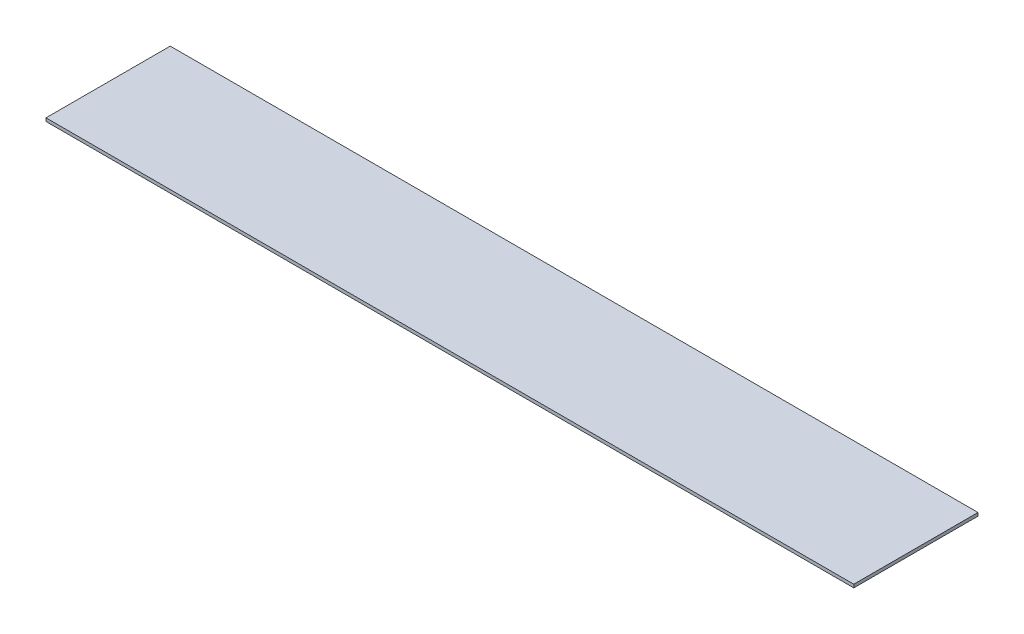
from build123d import *

# Parameters (mm, degrees)
SKETCH1_W           = 1201.674
SKETCH1_H           = 184.792366
BOSS_EXTRUDE2_DEPTH = 4.7625


with BuildPart() as part:
    # Sketch1 → Boss-Extrude2 (new body)
    with BuildSketch(Plane(origin=(0, 0, 0), x_dir=(1, 0, 0), z_dir=(0, 1, 0))):
        with Locations((541.708051813, 63.995664579)):
            Rectangle(SKETCH1_W, SKETCH1_H)
    extrude(amount=BOSS_EXTRUDE2_DEPTH)


solid = part.part
